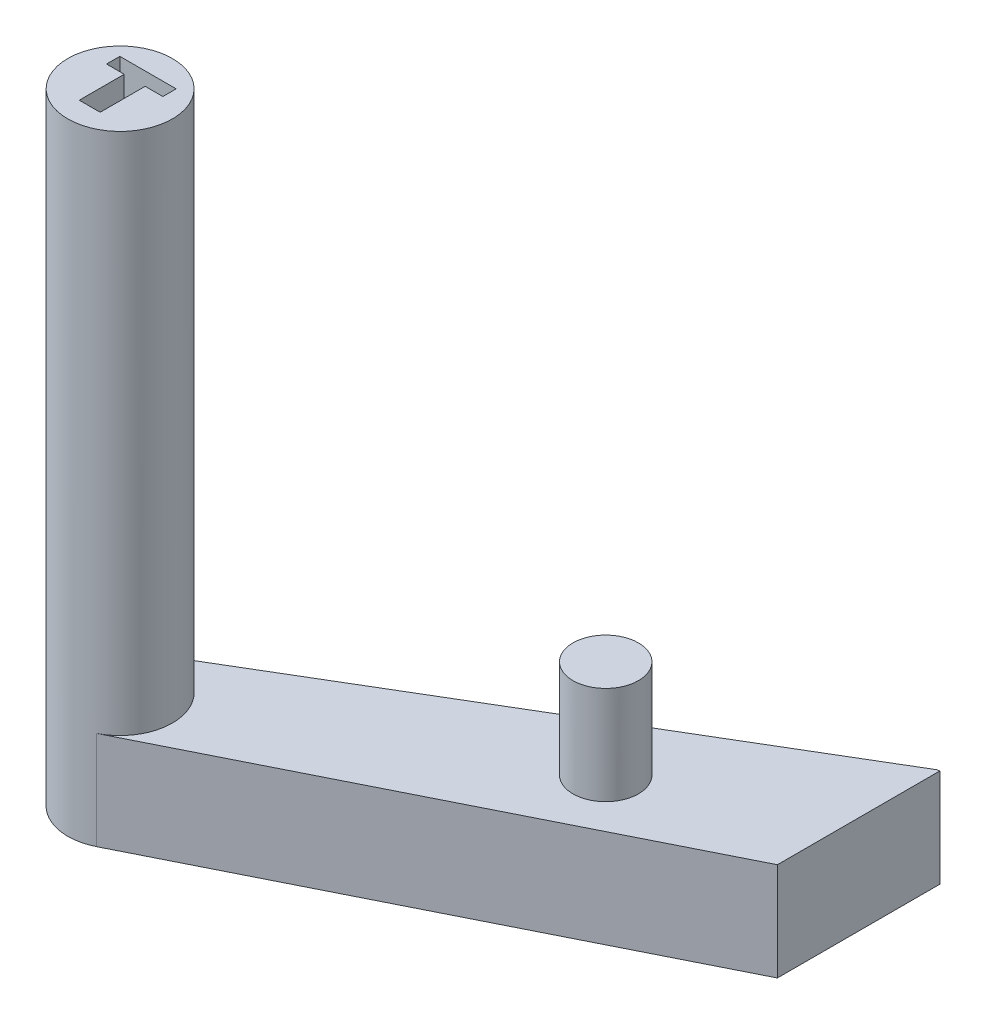
from build123d import *

# Parameters (mm, degrees)
SKETCH1_R           = 8
BOSS_EXTRUDE1_DEPTH = 95
SKETCH2_R           = 4
CUT_EXTRUDE1_DEPTH  = 45
SKETCH3_W           = 8.60885167
SKETCH3_H           = 2.035138461
SKETCH3_W_2         = 3.196177608
SKETCH3_H_2         = 6.875388446
CUT_EXTRUDE2_DEPTH  = 40
BOSS_EXTRUDE2_DEPTH = 15
SKETCH5_R           = 5
BOSS_EXTRUDE3_DEPTH = 15


with BuildPart() as part:
    # Sketch1 → Boss-Extrude1 (new body)
    with BuildSketch(Plane(origin=(0, 0, 0), x_dir=(1, 0, 0), z_dir=(0, 1, 0))):
        with Locations(Location((0, 0, 0), (0, 0, 270))):
            Circle(SKETCH1_R)
    extrude(amount=BOSS_EXTRUDE1_DEPTH)

    # Sketch2 → Cut-Extrude1 (cut)
    with BuildSketch(Plane.XZ):
        with Locations(Location((0, 0, 0), (0, 0, 270))):
            Circle(SKETCH2_R)
    extrude(amount=-CUT_EXTRUDE1_DEPTH, mode=Mode.SUBTRACT)

    # Sketch3 → Cut-Extrude2 (cut)
    with BuildSketch(Plane(origin=(0, 95, 0), x_dir=(1, 0, 0), z_dir=(0, 1, 0))):
        with Locations((0, 3.24887213)):
            Rectangle(SKETCH3_W, SKETCH3_H)
        with Locations((0, -1.206391324)):
            Rectangle(SKETCH3_W_2, SKETCH3_H_2)
    extrude(amount=-CUT_EXTRUDE2_DEPTH, mode=Mode.SUBTRACT)

    # Sketch4 → Boss-Extrude2 (add)
    with BuildSketch(Plane.XZ):
        with BuildLine():
            ThreePointArc((72.61474538, -52.266719107), (72.807969556, -52.302734502), (73.001736138, -52.33570725))
            Line((73.001736138, -52.33570725), (73.001736138, -27.496744571))
            Line((73.001736138, -27.496744571), (3.57279106, 7.157874268))
            ThreePointArc((3.57279106, 7.157874268), (7.382913261, -3.081004996), (-2.575137965, -7.574210484))
            Line((-2.575137965, -7.574210484), (72.61474538, -52.266719107))
        make_face()
    extrude(amount=-BOSS_EXTRUDE2_DEPTH)

    # Sketch5 → Boss-Extrude3 (add)
    with BuildSketch(Plane(origin=(0, 15, 0), x_dir=(1, 0, 0), z_dir=(0, 1, 0))):
        with Locations(Location((48.001736138, 26.246610631, 0), (0, 0, 90))):
            Circle(SKETCH5_R)
    extrude(amount=BOSS_EXTRUDE3_DEPTH)

    # Sketch9 → Cut-Revolve2 (revolve, cut)
    with BuildSketch(Plane(origin=(0, 0, 0), x_dir=(0.6901743919423456, 0, -0.7236430810192366), z_dir=(-0.7236430810192366, 0, -0.6901743919423456)), mode=Mode.PRIVATE) as cut_revolve2_sk:
        Polygon((-4, -45), (0, -45), (0, -51.92820323), align=None)
    revolve(cut_revolve2_sk.sketch.rotate(Axis((0, 45, 0), (0, 1, 0)), 242.42131363), axis=Axis((0, 45, 0), (0, 1, 0)), mode=Mode.SUBTRACT)


solid = part.part
